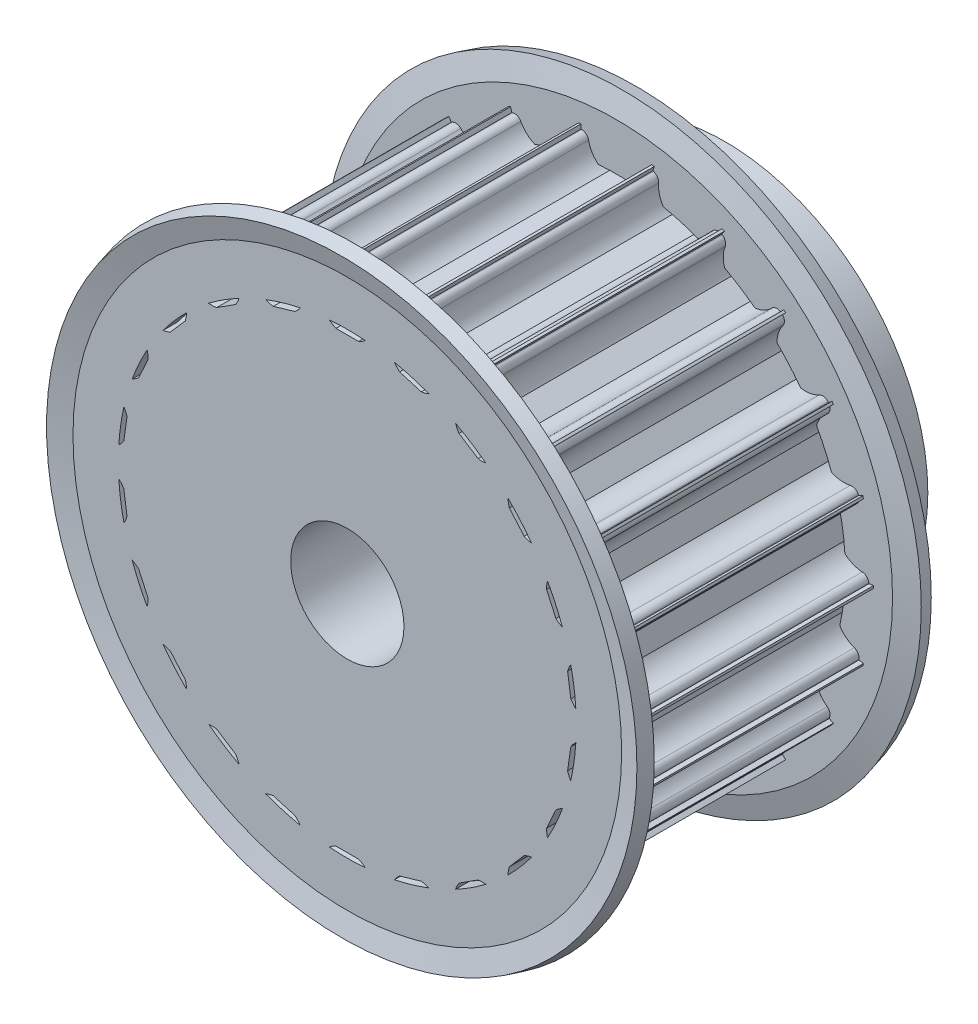
from build123d import *

# Parameters (mm, degrees)
CUT_EXTRUDE1_DEPTH = 56.543901555
CIRPATTERN1_COUNT  = 22


with BuildPart() as part:
    # Sketch1 → Revolve1 (revolve)
    with BuildSketch(Plane(origin=(0, 0, 0), x_dir=(0, 0, -1), z_dir=(1, 0, 0)), mode=Mode.PRIVATE) as revolve1_sk:
        Polygon((0, 6), (0, 27.25), (30, 27.25), (30, 21.5), (40, 21.5), (40, 6), align=None)
    revolve(revolve1_sk.sketch.rotate(Axis((0, 0, 55), (0, 0, -1)), 90), axis=Axis((0, 0, 55), (0, 0, -1)))

    # Sketch2 → Cut-Extrude1 (cut, through all)
    with BuildSketch(Plane.XY):
        with BuildLine():
            Line((3.674234614, 26.5), (3.75, 26.5))
            Line((3.75, 26.5), (3.75, 28.5))
            Line((3.75, 28.5), (-3.75, 28.5))
            Line((-3.75, 28.5), (-3.75, 26.5))
            Line((-3.75, 26.5), (-3.674234614, 26.5))
            ThreePointArc((-3.674234614, 26.5), (-3.199892965, 26.330947502), (-2.939387691, 25.9))
            ThreePointArc((-2.939387691, 25.9), (-2.331759211, 24.612435701), (-1.198957881, 23.75))
            Line((-1.198957881, 23.75), (1.198957881, 23.75))
            ThreePointArc((1.198957881, 23.75), (2.331759211, 24.612435701), (2.939387691, 25.9))
            ThreePointArc((2.939387691, 25.9), (3.199892965, 26.330947502), (3.674234614, 26.5))
        make_face()
    cut_extrude1 = extrude(amount=-CUT_EXTRUDE1_DEPTH, mode=Mode.SUBTRACT)

    # CirPattern1: Cut-Extrude1 ×22 about axis
    cirpattern1_axis = Axis((0, 0, 0), (0, 0, 1))
    for i in range(1, CIRPATTERN1_COUNT):
        add(cut_extrude1.rotate(cirpattern1_axis, i * 360 / CIRPATTERN1_COUNT), mode=Mode.SUBTRACT)

    # Sketch3 → Revolve2 (revolve)
    with BuildSketch(Plane(origin=(0, 0, 0), x_dir=(0, 0, -1), z_dir=(1, 0, 0)), mode=Mode.PRIVATE) as revolve2_sk:
        Polygon((0, 29.063196894), (0, 24.26067564), (1.5, 24.26067564), (1.5, 29.26067564), (0.856921938, 31.66067564), (-0.591966801, 31.272447072), align=None)
        Polygon((30.591966801, 31.272447072), (29.143078062, 31.66067564), (28.5, 29.26067564), (28.5, 24.26067564), (30, 24.26067564), (30, 29.063196894), align=None)
    revolve(revolve2_sk.sketch.rotate(Axis((0, 0, 55), (0, 0, -1)), 90), axis=Axis((0, 0, 55), (0, 0, -1)))


solid = part.part
